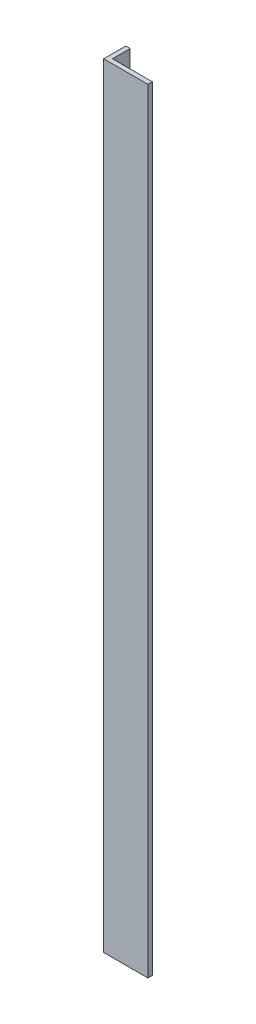
from build123d import *

# Parameters (mm, degrees)
BOSS_EXTRUDE1_DEPTH      = 350
F_3_0_3_DIAMETER_HOLE2_D = 3
F_3_0_3_DIAMETER_HOLE3_D = 3


with BuildPart() as part:
    # Sketch1 → Boss-Extrude1 (new body)
    with BuildSketch(Plane(origin=(0, 0, 0), x_dir=(1, 0, 0), z_dir=(0, 1, 0))):
        Polygon((0, 0), (0, 10), (2, 10), (2, 2), (20, 2), (20, 0), align=None)
    extrude(amount=BOSS_EXTRUDE1_DEPTH)

    # Ø3.0 (3) Diameter Hole2 (through all)
    with Locations(Plane(origin=(0, -11.407632793, -241.32004832), x_dir=(0, 0, 1), z_dir=(-1, 0, 0))):
        with Locations((235.32004832, 341.407632793), (235.32004832, 355.407632793)):
            Hole(F_3_0_3_DIAMETER_HOLE2_D / 2)

    # Ø3.0 (3) Diameter Hole3 (through all)
    with Locations(Plane(origin=(0, -11.407632793, -241.32004832), x_dir=(0, 0, 1), z_dir=(-1, 0, 0))):
        with Locations((235.663194071, 17.407632793), (235.32004832, 31.40342684)):
            Hole(F_3_0_3_DIAMETER_HOLE3_D / 2)


solid = part.part
